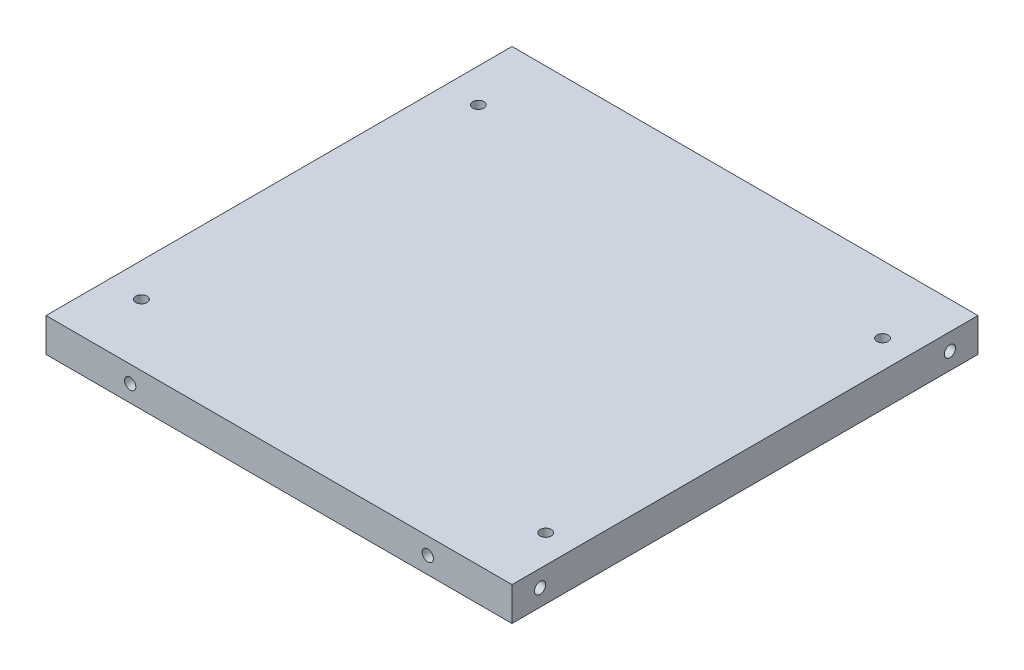
from build123d import *

# Parameters (mm, degrees)
SKETCH1_W            = 83
SKETCH1_H            = 83
BOSS_EXTRUDE1_DEPTH  = 6
SKETCH2_R            = 1
CUT_EXTRUDE1_DEPTH   = 6
LPATTERN1_COUNT      = 2
LPATTERN1_PITCH      = 72
LPATTERN1_COUNT_DIR2 = 2
LPATTERN1_PITCH_DIR2 = 60
SKETCH3_R            = 1
CUT_EXTRUDE2_DEPTH   = 10
SKETCH4_R            = 1
CUT_EXTRUDE3_DEPTH   = 10


with BuildPart() as part:
    # Sketch1 → Boss-Extrude1 (new body)
    with BuildSketch(Plane(origin=(0, 0, 0), x_dir=(1, 0, 0), z_dir=(0, 1, 0))):
        with Locations((41.5, 41.5)):
            Rectangle(SKETCH1_W, SKETCH1_H)
    extrude(amount=BOSS_EXTRUDE1_DEPTH)

    # Sketch2 → Cut-Extrude1 (cut)
    with BuildSketch(Plane(origin=(0, 6, 0), x_dir=(1, 0, 0), z_dir=(0, 1, 0))):
        with Locations(Location((6, 71, 0), (0, 0, 270))):
            Circle(SKETCH2_R)
    cut_extrude1 = extrude(amount=-CUT_EXTRUDE1_DEPTH, mode=Mode.SUBTRACT)

    # LPattern1: Cut-Extrude1 2 × 2
    with Locations(*[(i * LPATTERN1_PITCH, 0, j * LPATTERN1_PITCH_DIR2) for i in range(LPATTERN1_COUNT) for j in range(LPATTERN1_COUNT_DIR2) if (i, j) != (0, 0)]):
        add(cut_extrude1, mode=Mode.SUBTRACT)

    # Sketch3 → Cut-Extrude2 (cut)
    with BuildSketch(Plane.ZY):
        with Locations((-78, 3)):
            Circle(SKETCH3_R)
        with Locations((-5, 3)):
            Circle(SKETCH3_R)
    cut_extrude2 = extrude(amount=-CUT_EXTRUDE2_DEPTH, mode=Mode.SUBTRACT)

    # Mirror1: Cut-Extrude2 across plane
    add(cut_extrude2.mirror(Plane.ZY.offset(-41.5)), mode=Mode.SUBTRACT)

    # Sketch4 → Cut-Extrude3 (cut)
    with BuildSketch(Plane.XY):
        with Locations((15, 3)):
            Circle(SKETCH4_R)
        with Locations((68, 3)):
            Circle(SKETCH4_R)
    cut_extrude3 = extrude(amount=-CUT_EXTRUDE3_DEPTH, mode=Mode.SUBTRACT)

    # Mirror2: Cut-Extrude3 across plane
    add(cut_extrude3.mirror(Plane.XY.offset(-41.5)), mode=Mode.SUBTRACT)


solid = part.part
